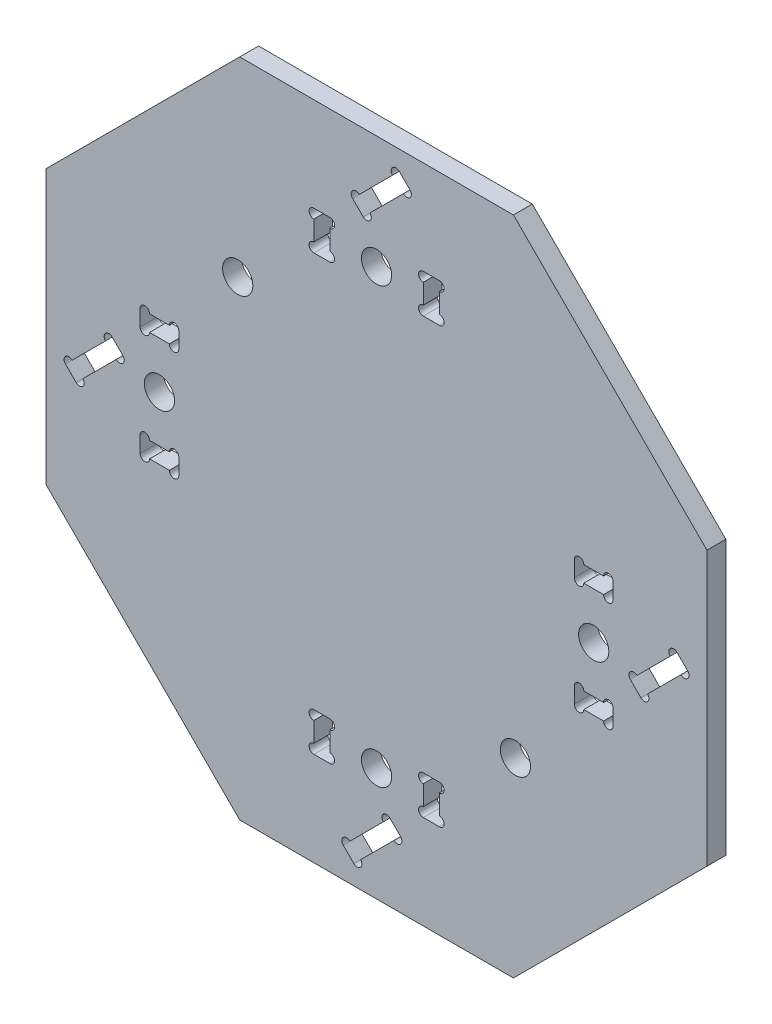
from build123d import *

# Parameters (mm, degrees)
SKETCH1_W           = 4.1
SKETCH1_H           = 1.7
SKETCH1_W_2         = 1.7
SKETCH1_H_2         = 4.1
BOSS_EXTRUDE1_DEPTH = 2
CUT_EXTRUDE1_REACH  = 51.538
SKETCH2_R           = 1.6
CUT_EXTRUDE2_REACH  = 51.538
SKETCH4_R           = 0.5
CUT_EXTRUDE3_DEPTH  = 2
CUT_EXTRUDE4_REACH  = 51.538
SKETCH5_R           = 1.6


with BuildPart() as part:
    # Sketch1 → Boss-Extrude1 (new body)
    with BuildSketch(Plane.XY):
        Polygon((-14.497474683, 35), (14.497474683, 35), (35, 14.497474683), (35, -14.497474683), (14.497474683, -35), (-14.497474683, -35), (-35, -14.497474683), (-35, 14.497474683), align=None)
        with Locations((-23, 5.8)):
            Rectangle(SKETCH1_W, SKETCH1_H, mode=Mode.SUBTRACT)
        with Locations((5.8, 23)):
            Rectangle(SKETCH1_W_2, SKETCH1_H_2, mode=Mode.SUBTRACT)
        with Locations((-23, -5.8)):
            Rectangle(SKETCH1_W, SKETCH1_H, mode=Mode.SUBTRACT)
        with Locations((-5.8, 23)):
            Rectangle(SKETCH1_W_2, SKETCH1_H_2, mode=Mode.SUBTRACT)
        with Locations((23, -5.8)):
            Rectangle(SKETCH1_W, SKETCH1_H, mode=Mode.SUBTRACT)
        with Locations((23, 5.8)):
            Rectangle(SKETCH1_W, SKETCH1_H, mode=Mode.SUBTRACT)
        with Locations((-5.8, -23)):
            Rectangle(SKETCH1_W_2, SKETCH1_H_2, mode=Mode.SUBTRACT)
        with Locations((5.8, -23)):
            Rectangle(SKETCH1_W_2, SKETCH1_H_2, mode=Mode.SUBTRACT)
    extrude(amount=BOSS_EXTRUDE1_DEPTH)

    # Sketch2 → Cut-Extrude1 (cut, up to next)
    with BuildSketch(Plane.XY.offset(2), mode=Mode.PRIVATE) as cut_extrude1_sk1:
        with Locations((-23, 0)):
            Circle(SKETCH2_R)
    cut_extrude1_tool1 = extrude(cut_extrude1_sk1.sketch, amount=-CUT_EXTRUDE1_REACH, mode=Mode.PRIVATE) & part.part
    # Sketch2 → Cut-Extrude1 (cut, up to next)
    with BuildSketch(Plane.XY.offset(2), mode=Mode.PRIVATE) as cut_extrude1_sk2:
        with Locations((0, 23)):
            Circle(SKETCH2_R)
    cut_extrude1_tool2 = extrude(cut_extrude1_sk2.sketch, amount=-CUT_EXTRUDE1_REACH, mode=Mode.PRIVATE) & part.part
    # Sketch2 → Cut-Extrude1 (cut, up to next)
    with BuildSketch(Plane.XY.offset(2), mode=Mode.PRIVATE) as cut_extrude1_sk3:
        with Locations((23, 0)):
            Circle(SKETCH2_R)
    cut_extrude1_tool3 = extrude(cut_extrude1_sk3.sketch, amount=-CUT_EXTRUDE1_REACH, mode=Mode.PRIVATE) & part.part
    # Sketch2 → Cut-Extrude1 (cut, up to next)
    with BuildSketch(Plane.XY.offset(2), mode=Mode.PRIVATE) as cut_extrude1_sk4:
        with Locations((0, -23)):
            Circle(SKETCH2_R)
    cut_extrude1_tool4 = extrude(cut_extrude1_sk4.sketch, amount=-CUT_EXTRUDE1_REACH, mode=Mode.PRIVATE) & part.part
    add(cut_extrude1_tool1.solids().sort_by_distance((-23, 0, 2))[0], mode=Mode.SUBTRACT)
    add(cut_extrude1_tool2.solids().sort_by_distance((0, 23, 2))[0], mode=Mode.SUBTRACT)
    add(cut_extrude1_tool3.solids().sort_by_distance((23, 0, 2))[0], mode=Mode.SUBTRACT)
    add(cut_extrude1_tool4.solids().sort_by_distance((0, -23, 2))[0], mode=Mode.SUBTRACT)

    # Sketch3 → Cut-Extrude2 (cut, up to next)
    with BuildSketch(Plane.XY.offset(2), mode=Mode.PRIVATE) as cut_extrude2_sk1:
        with BuildLine():
            Line((-32.244069222, -1.697056275), (-28.708535316, 1.838477631))
            ThreePointArc((-28.708535316, 1.838477631), (-28.708535316, 2.545584412), (-28.001428535, 2.545584412))
            Line((-28.001428535, 2.545584412), (-26.870057685, 1.414213562))
            ThreePointArc((-26.870057685, 1.414213562), (-26.870057685, 0.707106781), (-27.577164466, 0.707106781))
            Line((-27.577164466, 0.707106781), (-31.112698372, -2.828427125))
            ThreePointArc((-31.112698372, -2.828427125), (-31.112698372, -3.535533906), (-31.819805153, -3.535533906))
            Line((-31.819805153, -3.535533906), (-32.951176003, -2.404163056))
            ThreePointArc((-32.951176003, -2.404163056), (-32.951176003, -1.697056275), (-32.244069222, -1.697056275))
        make_face()
    cut_extrude2_tool1 = extrude(cut_extrude2_sk1.sketch, amount=-CUT_EXTRUDE2_REACH, mode=Mode.PRIVATE) & part.part
    # Sketch3 → Cut-Extrude2 (cut, up to next)
    with BuildSketch(Plane.XY.offset(2), mode=Mode.PRIVATE) as cut_extrude2_sk2:
        with BuildLine():
            Line((-3.535533906, -31.819805153), (-2.404163056, -32.951176003))
            ThreePointArc((-2.404163056, -32.951176003), (-1.697056275, -32.951176003), (-1.697056275, -32.244069222))
            Line((-1.697056275, -32.244069222), (1.838477631, -28.708535316))
            ThreePointArc((1.838477631, -28.708535316), (2.545584412, -28.708535316), (2.545584412, -28.001428535))
            Line((2.545584412, -28.001428535), (1.414213562, -26.870057685))
            ThreePointArc((1.414213562, -26.870057685), (0.707106781, -26.870057685), (0.707106781, -27.577164466))
            Line((0.707106781, -27.577164466), (-2.828427125, -31.112698372))
            ThreePointArc((-2.828427125, -31.112698372), (-3.535533906, -31.112698372), (-3.535533906, -31.819805153))
        make_face()
    cut_extrude2_tool2 = extrude(cut_extrude2_sk2.sketch, amount=-CUT_EXTRUDE2_REACH, mode=Mode.PRIVATE) & part.part
    # Sketch3 → Cut-Extrude2 (cut, up to next)
    with BuildSketch(Plane.XY.offset(2), mode=Mode.PRIVATE) as cut_extrude2_sk3:
        with BuildLine():
            Line((32.244069222, 1.697056275), (28.708535316, -1.838477631))
            ThreePointArc((28.708535316, -1.838477631), (28.708535316, -2.545584412), (28.001428535, -2.545584412))
            Line((28.001428535, -2.545584412), (26.870057685, -1.414213562))
            ThreePointArc((26.870057685, -1.414213562), (26.870057685, -0.707106781), (27.577164466, -0.707106781))
            Line((27.577164466, -0.707106781), (31.112698372, 2.828427125))
            ThreePointArc((31.112698372, 2.828427125), (31.112698372, 3.535533906), (31.819805153, 3.535533906))
            Line((31.819805153, 3.535533906), (32.951176003, 2.404163056))
            ThreePointArc((32.951176003, 2.404163056), (32.951176003, 1.697056275), (32.244069222, 1.697056275))
        make_face()
    cut_extrude2_tool3 = extrude(cut_extrude2_sk3.sketch, amount=-CUT_EXTRUDE2_REACH, mode=Mode.PRIVATE) & part.part
    # Sketch3 → Cut-Extrude2 (cut, up to next)
    with BuildSketch(Plane.XY.offset(2), mode=Mode.PRIVATE) as cut_extrude2_sk4:
        with BuildLine():
            Line((3.535533906, 31.819805153), (2.404163056, 32.951176003))
            ThreePointArc((2.404163056, 32.951176003), (1.697056275, 32.951176003), (1.697056275, 32.244069222))
            Line((1.697056275, 32.244069222), (-1.838477631, 28.708535316))
            ThreePointArc((-1.838477631, 28.708535316), (-2.545584412, 28.708535316), (-2.545584412, 28.001428535))
            Line((-2.545584412, 28.001428535), (-1.414213562, 26.870057685))
            ThreePointArc((-1.414213562, 26.870057685), (-0.707106781, 26.870057685), (-0.707106781, 27.577164466))
            Line((-0.707106781, 27.577164466), (2.828427125, 31.112698372))
            ThreePointArc((2.828427125, 31.112698372), (3.535533906, 31.112698372), (3.535533906, 31.819805153))
        make_face()
    cut_extrude2_tool4 = extrude(cut_extrude2_sk4.sketch, amount=-CUT_EXTRUDE2_REACH, mode=Mode.PRIVATE) & part.part
    add(cut_extrude2_tool1.solids().sort_by_distance((-29.910617, -0.494975, 2))[0], mode=Mode.SUBTRACT)
    add(cut_extrude2_tool2.solids().sort_by_distance((-0.494975, -29.910617, 2))[0], mode=Mode.SUBTRACT)
    add(cut_extrude2_tool3.solids().sort_by_distance((29.910617, 0.494975, 2))[0], mode=Mode.SUBTRACT)
    add(cut_extrude2_tool4.solids().sort_by_distance((0.494975, 29.910617, 2))[0], mode=Mode.SUBTRACT)

    # Sketch4 → Cut-Extrude3 (cut)
    with BuildSketch(Plane.XY.offset(2)):
        with Locations((-24.55, 6.65)):
            Circle(SKETCH4_R)
        with Locations((-24.55, 4.95)):
            Circle(SKETCH4_R)
        with Locations((-21.45, 6.65)):
            Circle(SKETCH4_R)
        with Locations((-21.45, 4.95)):
            Circle(SKETCH4_R)
        with Locations((-21.45, -4.95)):
            Circle(SKETCH4_R)
        with Locations((-21.45, -6.65)):
            Circle(SKETCH4_R)
        with Locations((-24.55, -4.95)):
            Circle(SKETCH4_R)
        with Locations((-24.55, -6.65)):
            Circle(SKETCH4_R)
        with Locations((6.65, 24.55)):
            Circle(SKETCH4_R)
        with Locations((4.95, 24.55)):
            Circle(SKETCH4_R)
        with Locations((6.65, 21.45)):
            Circle(SKETCH4_R)
        with Locations((4.95, 21.45)):
            Circle(SKETCH4_R)
        with Locations((-4.95, 21.45)):
            Circle(SKETCH4_R)
        with Locations((-6.65, 21.45)):
            Circle(SKETCH4_R)
        with Locations((-4.95, 24.55)):
            Circle(SKETCH4_R)
        with Locations((-6.65, 24.55)):
            Circle(SKETCH4_R)
        with Locations((24.55, -6.65)):
            Circle(SKETCH4_R)
        with Locations((24.55, -4.95)):
            Circle(SKETCH4_R)
        with Locations((21.45, -6.65)):
            Circle(SKETCH4_R)
        with Locations((21.45, -4.95)):
            Circle(SKETCH4_R)
        with Locations((21.45, 4.95)):
            Circle(SKETCH4_R)
        with Locations((21.45, 6.65)):
            Circle(SKETCH4_R)
        with Locations((24.55, 4.95)):
            Circle(SKETCH4_R)
        with Locations((24.55, 6.65)):
            Circle(SKETCH4_R)
        with Locations((-6.65, -24.55)):
            Circle(SKETCH4_R)
        with Locations((-4.95, -24.55)):
            Circle(SKETCH4_R)
        with Locations((-6.65, -21.45)):
            Circle(SKETCH4_R)
        with Locations((-4.95, -21.45)):
            Circle(SKETCH4_R)
        with Locations((4.95, -21.45)):
            Circle(SKETCH4_R)
        with Locations((6.65, -21.45)):
            Circle(SKETCH4_R)
        with Locations((4.95, -24.55)):
            Circle(SKETCH4_R)
        with Locations((6.65, -24.55)):
            Circle(SKETCH4_R)
    extrude(amount=-CUT_EXTRUDE3_DEPTH, mode=Mode.SUBTRACT)

    # Sketch5 → Cut-Extrude4 (cut, up to next)
    with BuildSketch(Plane.XY.offset(2), mode=Mode.PRIVATE) as cut_extrude4_sk1:
        with Locations((-14.707821049, 14.707821049)):
            Circle(SKETCH5_R)
    cut_extrude4_tool1 = extrude(cut_extrude4_sk1.sketch, amount=-CUT_EXTRUDE4_REACH, mode=Mode.PRIVATE) & part.part
    # Sketch5 → Cut-Extrude4 (cut, up to next)
    with BuildSketch(Plane.XY.offset(2), mode=Mode.PRIVATE) as cut_extrude4_sk2:
        with Locations((14.707821049, -14.707821049)):
            Circle(SKETCH5_R)
    cut_extrude4_tool2 = extrude(cut_extrude4_sk2.sketch, amount=-CUT_EXTRUDE4_REACH, mode=Mode.PRIVATE) & part.part
    add(cut_extrude4_tool1.solids().sort_by_distance((-14.707821, 14.707821, 2))[0], mode=Mode.SUBTRACT)
    add(cut_extrude4_tool2.solids().sort_by_distance((14.707821, -14.707821, 2))[0], mode=Mode.SUBTRACT)


solid = part.part
